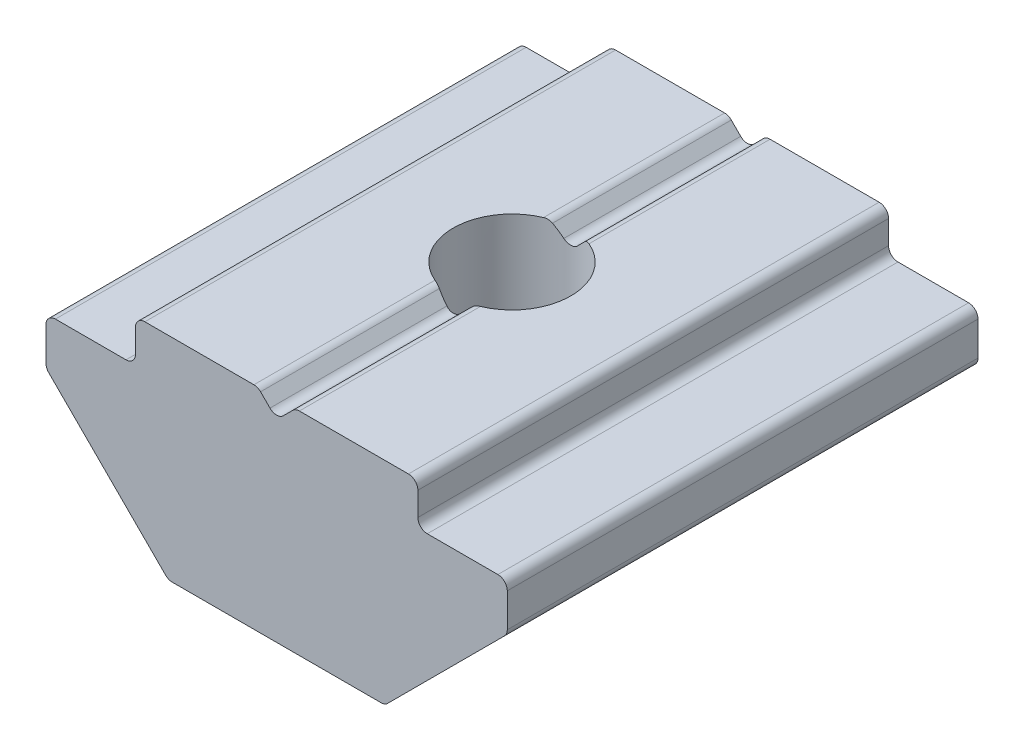
from build123d import *

# Parameters (mm, degrees)
BOSS_EXTRUDE1_DEPTH            = 10
SKETCH2_W                      = 1.9
SKETCH2_H                      = 0.9
CUT_EXTRUDE1_DEPTH             = 12.703418304
SKETCH3_W                      = 1.9
SKETCH3_H                      = 0.9
CUT_EXTRUDE2_DEPTH             = 12.703418304
CUT_EXTRUDE3_DEPTH             = 12.703418304
F_4_2_4_2_DIAMETER_HOLE1_D     = 2.5
F_4_2_4_2_DIAMETER_HOLE1_DEPTH = 4.5
FILLET1_R                      = 0.2


with BuildPart() as part:
    # Sketch1 → Boss-Extrude1 (new body)
    with BuildSketch(Plane.XY.offset(5)):
        Polygon((4.9, -1), (4.9, 0.9), (-4.9, 0.9), (-4.9, -1), (-2.3, -3.6), (2.3, -3.6), align=None)
    extrude(amount=-BOSS_EXTRUDE1_DEPTH)

    # Sketch2 → Cut-Extrude1 (cut, through all)
    with BuildSketch(Plane(origin=(0, 0, -5), x_dir=(-1, 0, 0), z_dir=(0, 0, -1))):
        with Locations((3.95, 0.45)):
            Rectangle(SKETCH2_W, SKETCH2_H)
    extrude(amount=-CUT_EXTRUDE1_DEPTH, mode=Mode.SUBTRACT)

    # Sketch3 → Cut-Extrude2 (cut, through all)
    with BuildSketch(Plane(origin=(0, 0, -5), x_dir=(-1, 0, 0), z_dir=(0, 0, -1))):
        with Locations((-3.95, 0.45)):
            Rectangle(SKETCH3_W, SKETCH3_H)
    extrude(amount=-CUT_EXTRUDE2_DEPTH, mode=Mode.SUBTRACT)

    # Sketch4 → Cut-Extrude3 (cut, through all)
    with BuildSketch(Plane(origin=(0, 0, -5), x_dir=(-1, 0, 0), z_dir=(0, 0, -1))):
        Polygon((0.4, 0.9), (-0.4, 0.9), (0, 0.5), align=None)
    extrude(amount=-CUT_EXTRUDE3_DEPTH, mode=Mode.SUBTRACT)

    # Ø4.2 (4.2) Diameter Hole1
    with Locations(Plane(origin=(0, -3.6, 0), x_dir=(-1, 0, 0), z_dir=(0, -1, 0))):
        with Locations((0, 0)):
            Hole(F_4_2_4_2_DIAMETER_HOLE1_D / 2, depth=F_4_2_4_2_DIAMETER_HOLE1_DEPTH)

    # Fillet1
    fillet1_edges = [part.edges().sort_by_distance(p)[0] for p in [
        (4.9, 0, 0),
        (3, 0, 0),
        (-4.9, -1, 0),
        (3, 0.9, 0),
        (-3, 0, 0),
        (0.4, 0.9, -3.092135964),
        (0, 0.5, 3.125),
        (-0.4, 0.9, -3.092135964),
        (4.9, -1, 0),
        (-3, 0.9, 0),
        (0, 0.5, -3.125),
        (-0.4, 0.9, 3.092135964),
        (-4.9, 0, 0),
        (-2.3, -3.6, 0),
        (0.4, 0.9, 3.092135964),
        (2.3, -3.6, 0),
    ]]
    fillet(fillet1_edges, radius=FILLET1_R)


solid = part.part
